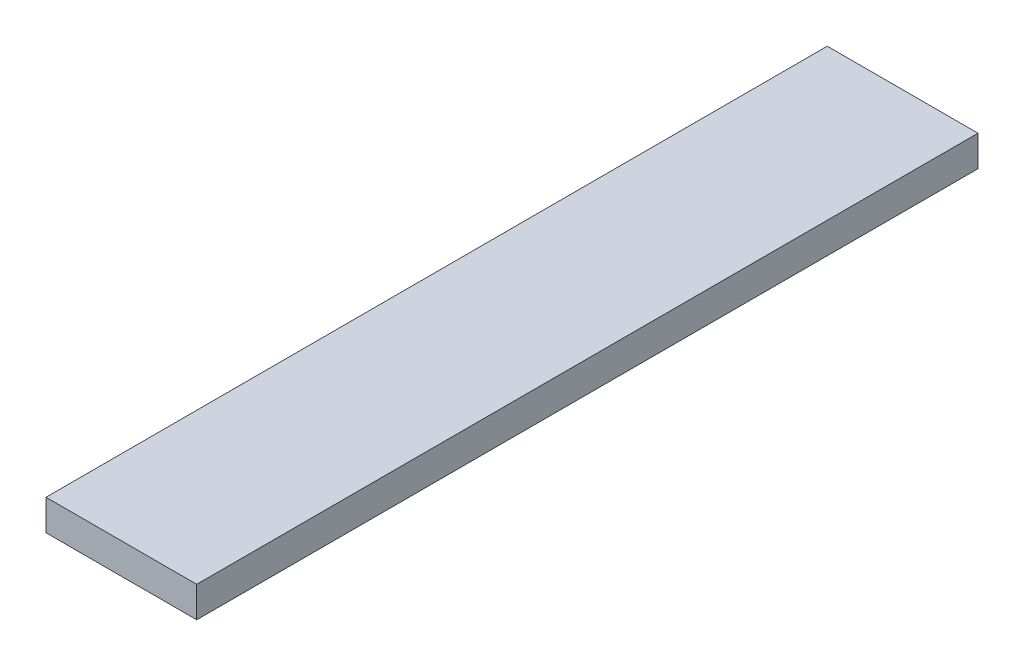
from build123d import *

# Parameters (mm, degrees)
SKETCH_1_W      = 9.8
SKETCH_1_H      = 50.8
EXTRUDE_1_DEPTH = 2


with BuildPart() as part:
    # 草图1 → 凸台-拉伸1 (new body)
    with BuildSketch(Plane(origin=(0, 0, 0), x_dir=(1, 0, 0), z_dir=(0, 1, 0))):
        Rectangle(SKETCH_1_W, SKETCH_1_H)
    extrude(amount=EXTRUDE_1_DEPTH)


solid = part.part
